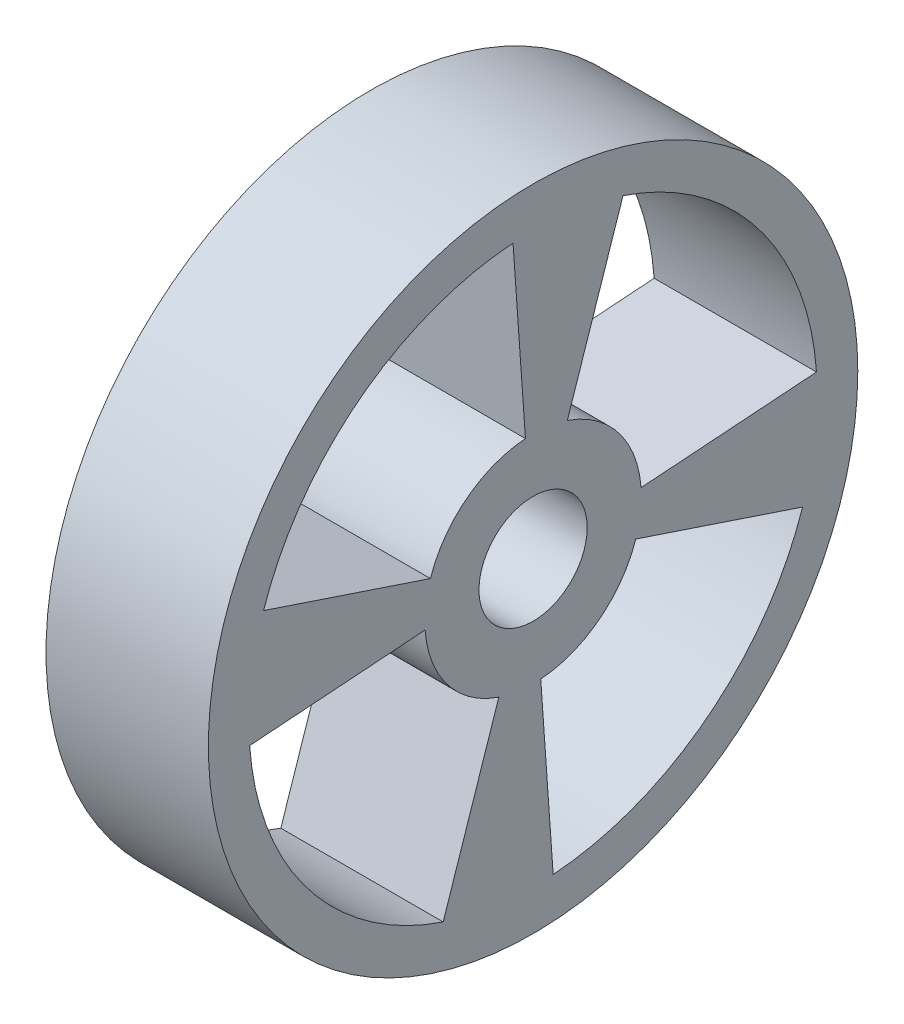
from build123d import *

# Parameters (mm, degrees)
SKETCH_2_R          = 12
SKETCH_2_R_2        = 10.5
SKETCH_2_R_3        = 4
SKETCH_2_R_4        = 2
BOSS_EXTRUDE1_DEPTH = 6


with BuildPart() as part:
    # 草图2 → Boss-Extrude1 (new body)
    # profile 1 of 6: a face of its own
    with BuildSketch(Plane(origin=(0, 0, 0), x_dir=(0, 0, -1), z_dir=(1, 0, 0))):
        Circle(SKETCH_2_R)
        Circle(SKETCH_2_R_2, mode=Mode.SUBTRACT)
    # profile 2 of 6: a face of its own
    with BuildSketch(Plane(origin=(0, 0, 0), x_dir=(0, 0, -1), z_dir=(1, 0, 0))):
        with BuildLine():
            Line((-0.741872063, 10.473758917), (-0.282617929, 3.990003397))
            ThreePointArc((-0.282617929, 3.990003397), (0.501223543, 3.968472623), (1.265803275, 3.794435672))
            Line((1.265803275, 3.794435672), (3.322733597, 9.960393639))
            ThreePointArc((3.322733597, 9.960393639), (1.315711801, 10.417240635), (-0.741872063, 10.473758917))
        make_face()
    # profile 3 of 6: a face of its own
    with BuildSketch(Plane(origin=(0, 0, 0), x_dir=(0, 0, -1), z_dir=(1, 0, 0))):
        with BuildLine():
            Line((10.473758917, 0.741872063), (3.990003397, 0.282617929))
            ThreePointArc((3.990003397, 0.282617929), (3.997500068, 0.141397335), (4, 0))
            ThreePointArc((4, 0), (3.948274477, -0.64119315), (3.794435672, -1.265803275))
            Line((3.794435672, -1.265803275), (9.960393639, -3.322733597))
            ThreePointArc((9.960393639, -3.322733597), (10.364220502, -1.68313202), (10.5, 0))
            ThreePointArc((10.5, 0), (10.493437678, 0.371168005), (10.473758917, 0.741872063))
        make_face()
    # profile 4 of 6: a face of its own
    with BuildSketch(Plane(origin=(0, 0, 0), x_dir=(0, 0, -1), z_dir=(1, 0, 0))):
        with BuildLine():
            ThreePointArc((0.282617929, -3.990003397), (-0.501223543, -3.968472623), (-1.265803275, -3.794435672))
            Line((-1.265803275, -3.794435672), (-3.322733597, -9.960393639))
            ThreePointArc((-3.322733597, -9.960393639), (-1.315711801, -10.417240635), (0.741872063, -10.473758917))
            Line((0.741872063, -10.473758917), (0.282617929, -3.990003397))
        make_face()
    # profile 5 of 6: a face of its own
    with BuildSketch(Plane(origin=(0, 0, 0), x_dir=(0, 0, -1), z_dir=(1, 0, 0))):
        Circle(SKETCH_2_R_3)
        Circle(SKETCH_2_R_4, mode=Mode.SUBTRACT)
    # profile 6 of 6: a face of its own
    with BuildSketch(Plane(origin=(0, 0, 0), x_dir=(0, 0, -1), z_dir=(1, 0, 0))):
        with BuildLine():
            ThreePointArc((-3.990003397, -0.282617929), (-3.968472623, 0.501223543), (-3.794435672, 1.265803275))
            Line((-3.794435672, 1.265803275), (-9.960393639, 3.322733597))
            ThreePointArc((-9.960393639, 3.322733597), (-10.417240635, 1.315711801), (-10.473758917, -0.741872063))
            Line((-10.473758917, -0.741872063), (-3.990003397, -0.282617929))
        make_face()
    extrude(amount=BOSS_EXTRUDE1_DEPTH)


solid = part.part
